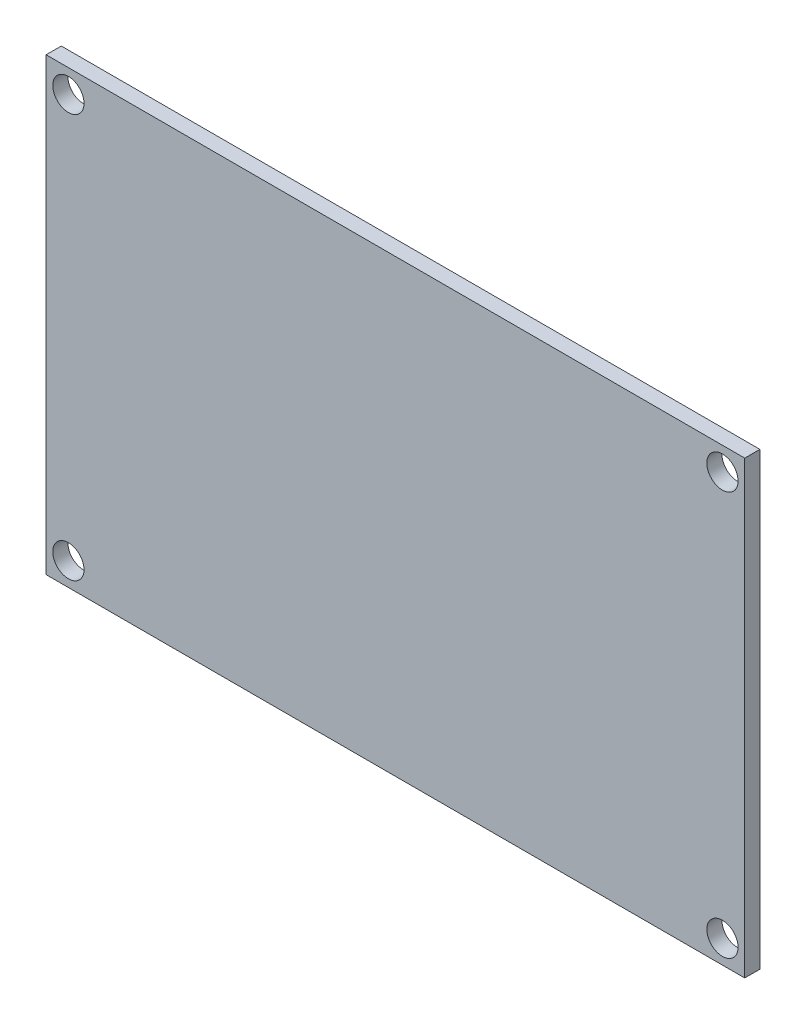
from build123d import *

# Parameters (mm, degrees)
SKETCH1_W           = 73.7
SKETCH1_H           = 47.5
SKETCH1_R           = 1.65
BOSS_EXTRUDE1_DEPTH = 1.6


with BuildPart() as part:
    # Sketch1 → Boss-Extrude1 (new body)
    with BuildSketch(Plane.XY):
        with Locations((36.85, 23.75)):
            Rectangle(SKETCH1_W, SKETCH1_H)
        with Locations((2.35, 45.05)):
            Circle(SKETCH1_R, mode=Mode.SUBTRACT)
        with Locations((71.35, 45.05)):
            Circle(SKETCH1_R, mode=Mode.SUBTRACT)
        with Locations((2.35, 2.45)):
            Circle(SKETCH1_R, mode=Mode.SUBTRACT)
        with Locations((71.35, 2.45)):
            Circle(SKETCH1_R, mode=Mode.SUBTRACT)
    extrude(amount=BOSS_EXTRUDE1_DEPTH)


solid = part.part
